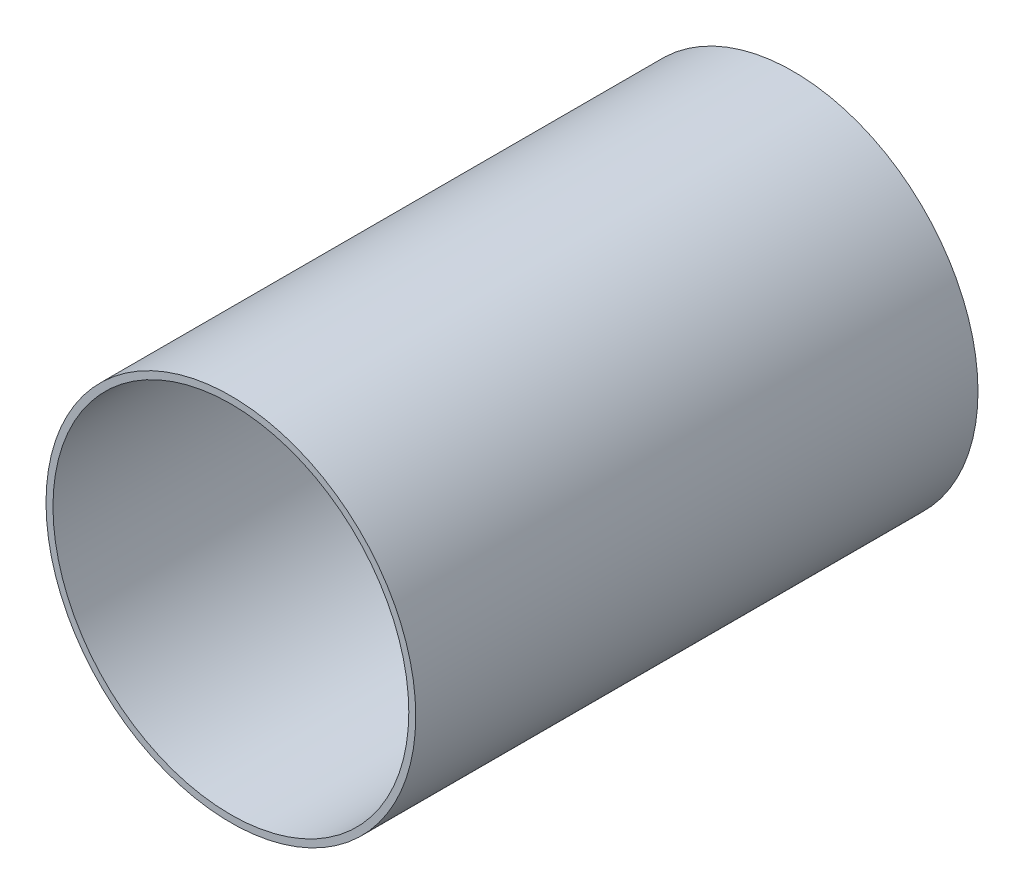
from build123d import *

# Parameters (mm, degrees)
SKETCH1_R           = 49.48555
SKETCH1_R_2         = 47.625
BOSS_EXTRUDE1_DEPTH = 150.495


with BuildPart() as part:
    # Sketch1 → Boss-Extrude1 (new body)
    with BuildSketch(Plane.XY):
        Circle(SKETCH1_R)
        Circle(SKETCH1_R_2, mode=Mode.SUBTRACT)
    extrude(amount=BOSS_EXTRUDE1_DEPTH)


solid = part.part
